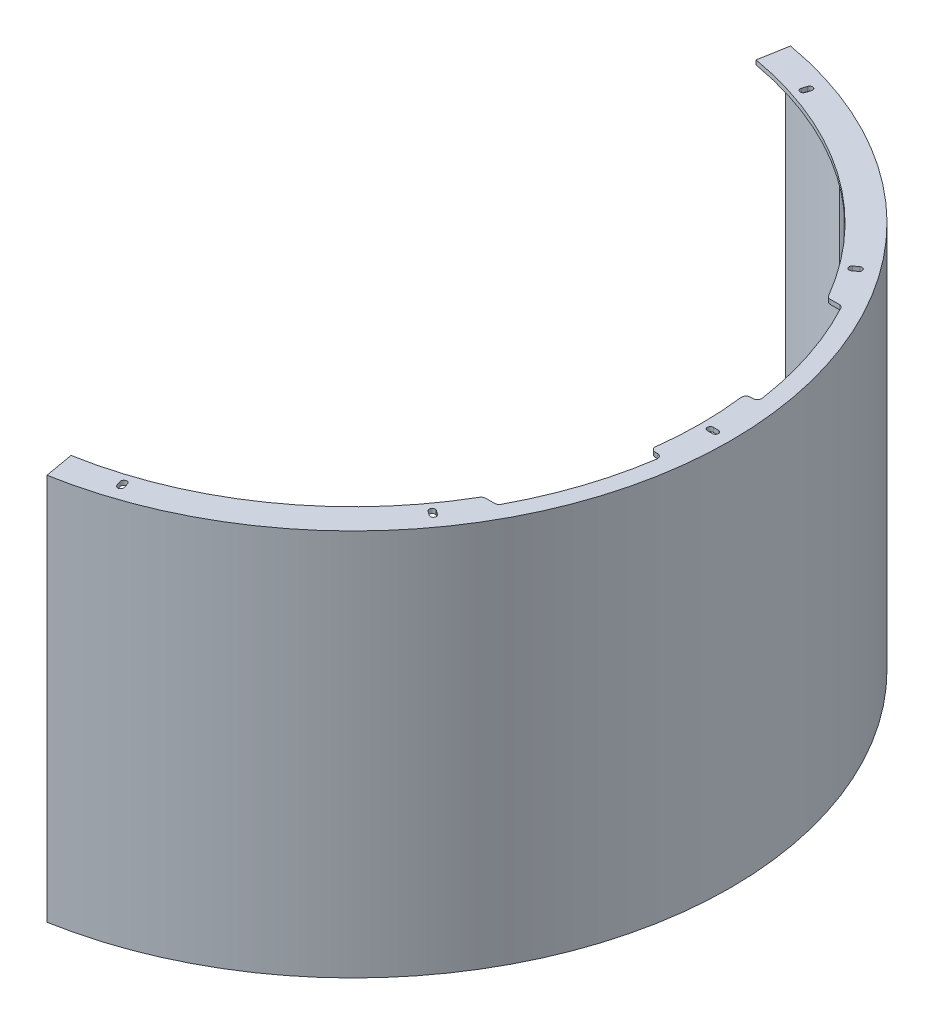
from build123d import *

# Parameters (mm, degrees)
BOSS_EXTRUDE1_DEPTH   = 255
BOSS_EXTRUDE2_DEPTH   = 255
BOSS_EXTRUDE2_2_DEPTH = 255
BOSS_EXTRUDE2_3_DEPTH = 255
BOSS_EXTRUDE2_4_DEPTH = 255
BOSS_EXTRUDE2_5_DEPTH = 255
BOSS_EXTRUDE2_6_DEPTH = 255
BOSS_EXTRUDE2_7_DEPTH = 255
BOSS_EXTRUDE2_8_DEPTH = 255
BOSS_EXTRUDE3_DEPTH   = 3
CUT_EXTRUDE3_DEPTH    = 5
LPATTERN1_COUNT       = 2
LPATTERN1_PITCH       = 258
LPATTERN2_COUNT       = 2
LPATTERN2_PITCH       = 258
CUT_EXTRUDE7_DEPTH    = 324
CUT_EXTRUDE10_DEPTH   = 5
FILLET2_R             = 3


with BuildPart() as part:
    # Sketch3 → Boss-Extrude1 (new body)
    with BuildSketch(Plane(origin=(0, 0, 0), x_dir=(1, 0, 0), z_dir=(0, 1, 0))):
        with BuildLine():
            ThreePointArc((0, -254.5), (-22.181136529, -253.531550664), (-44.193461216, -250.633573142))
            Line((-44.193461216, -250.633573142), (-43.672516683, -247.679149883))
            ThreePointArc((-43.672516683, -247.679149883), (-21.919669301, -250.54296657), (0, -251.5))
            ThreePointArc((0, -251.5), (251.5, 0), (0, 251.5))
            ThreePointArc((0, 251.5), (-21.919669301, 250.54296657), (-43.672516683, 247.679149883))
            Line((-43.672516683, 247.679149883), (-44.193461216, 250.633573142))
            ThreePointArc((-44.193461216, 250.633573142), (-22.181136529, 253.531550664), (0, 254.5))
            ThreePointArc((0, 254.5), (254.5, 0), (0, -254.5))
        make_face()
    extrude(amount=BOSS_EXTRUDE1_DEPTH)


with BuildPart() as body_2:
    # Sketch6 → Boss-Extrude2 (new body)
    with BuildSketch(Plane(origin=(0, 255, 0), x_dir=(1, 0, 0), z_dir=(0, 1, 0))):
        with BuildLine():
            Line((-2, -253.081926056), (2, -253.081926056))
            Line((2, -253.081926056), (2, -247.081926056))
            ThreePointArc((2, -247.081926056), (1.707106781, -246.374819275), (1, -246.081926056))
            Line((1, -246.081926056), (-1, -246.081926056))
            ThreePointArc((-1, -246.081926056), (-1.707106781, -246.374819275), (-2, -247.081926056))
            Line((-2, -247.081926056), (-2, -253.081926056))
        make_face()
    extrude(amount=-BOSS_EXTRUDE2_DEPTH)


with BuildPart() as body_3:
    # Sketch6 → Boss-Extrude2 2 (new body)
    with BuildSketch(Plane(origin=(0, 255, 0), x_dir=(1, 0, 0), z_dir=(0, 1, 0))):
        with BuildLine():
            Line((-1, 246.081926056), (1, 246.081926056))
            ThreePointArc((1, 246.081926056), (1.707106781, 246.374819275), (2, 247.081926056))
            Line((2, 247.081926056), (2, 253.081926056))
            Line((2, 253.081926056), (-2, 253.081926056))
            Line((-2, 253.081926056), (-2, 247.081926056))
            ThreePointArc((-2, 247.081926056), (-1.707106781, 246.374819275), (-1, 246.081926056))
        make_face()
    extrude(amount=-BOSS_EXTRUDE2_2_DEPTH)


with BuildPart() as body_4:
    # Sketch6 → Boss-Extrude2 3 (new body)
    with BuildSketch(Plane(origin=(0, 255, 0), x_dir=(1, 0, 0), z_dir=(0, 1, 0))):
        with BuildLine():
            Line((111.610070116, 227.151168927), (108.006194645, 228.886703884))
            Line((108.006194645, 228.886703884), (105.40289221, 223.480890676))
            ThreePointArc((105.40289221, 223.480890676), (105.359977747, 222.716727875), (105.869977339, 222.146038069))
            Line((105.869977339, 222.146038069), (107.671915074, 221.278270591))
            ThreePointArc((107.671915074, 221.278270591), (108.436077876, 221.235356129), (109.006767681, 221.74535572))
            Line((109.006767681, 221.74535572), (111.610070116, 227.151168927))
        make_face()
    extrude(amount=-BOSS_EXTRUDE2_3_DEPTH)


with BuildPart() as body_5:
    # Sketch6 → Boss-Extrude2 4 (new body)
    with BuildSketch(Plane(origin=(0, 255, 0), x_dir=(1, 0, 0), z_dir=(0, 1, 0))):
        with BuildLine():
            Line((199.114397038, 156.230336966), (196.620437831, 159.357662896))
            Line((196.620437831, 159.357662896), (191.929448936, 155.616724085))
            ThreePointArc((191.929448936, 155.616724085), (191.559226528, 154.946857078), (191.771107255, 154.2114028))
            Line((191.771107255, 154.2114028), (193.018086859, 152.647739835))
            ThreePointArc((193.018086859, 152.647739835), (193.687953865, 152.277517427), (194.423408143, 152.489398155))
            Line((194.423408143, 152.489398155), (199.114397038, 156.230336966))
        make_face()
    extrude(amount=-BOSS_EXTRUDE2_4_DEPTH)


with BuildPart() as body_6:
    # Sketch6 → Boss-Extrude2 5 (new body)
    with BuildSketch(Plane(origin=(0, 255, 0), x_dir=(1, 0, 0), z_dir=(0, 1, 0))):
        with BuildLine():
            Line((247.181675649, 54.366170729), (246.291591913, 58.265882378))
            Line((246.291591913, 58.265882378), (240.44202444, 56.930756774))
            ThreePointArc((240.44202444, 56.930756774), (239.817821175, 56.487860938), (239.689617462, 55.733307928))
            Line((239.689617462, 55.733307928), (240.13465933, 53.783452104))
            ThreePointArc((240.13465933, 53.783452104), (240.577555165, 53.159248838), (241.332108176, 53.031045125))
            Line((241.332108176, 53.031045125), (247.181675649, 54.366170729))
        make_face()
    extrude(amount=-BOSS_EXTRUDE2_5_DEPTH)


with BuildPart() as body_7:
    # Sketch6 → Boss-Extrude2 6 (new body)
    with BuildSketch(Plane(origin=(0, 255, 0), x_dir=(1, 0, 0), z_dir=(0, 1, 0))):
        with BuildLine():
            Line((246.291591913, -58.265882378), (247.181675649, -54.366170729))
            Line((247.181675649, -54.366170729), (241.332108176, -53.031045125))
            ThreePointArc((241.332108176, -53.031045125), (240.577555165, -53.159248838), (240.13465933, -53.783452104))
            Line((240.13465933, -53.783452104), (239.689617462, -55.733307928))
            ThreePointArc((239.689617462, -55.733307928), (239.817821175, -56.487860938), (240.44202444, -56.930756774))
            Line((240.44202444, -56.930756774), (246.291591913, -58.265882378))
        make_face()
    extrude(amount=-BOSS_EXTRUDE2_6_DEPTH)


with BuildPart() as body_8:
    # Sketch6 → Boss-Extrude2 7 (new body)
    with BuildSketch(Plane(origin=(0, 255, 0), x_dir=(1, 0, 0), z_dir=(0, 1, 0))):
        with BuildLine():
            Line((196.620437831, -159.357662896), (199.114397038, -156.230336966))
            Line((199.114397038, -156.230336966), (194.423408143, -152.489398155))
            ThreePointArc((194.423408143, -152.489398155), (193.687953865, -152.277517427), (193.018086859, -152.647739835))
            Line((193.018086859, -152.647739835), (191.771107255, -154.2114028))
            ThreePointArc((191.771107255, -154.2114028), (191.559226528, -154.946857078), (191.929448936, -155.616724085))
            Line((191.929448936, -155.616724085), (196.620437831, -159.357662896))
        make_face()
    extrude(amount=-BOSS_EXTRUDE2_7_DEPTH)


with BuildPart() as body_9:
    # Sketch6 → Boss-Extrude2 8 (new body)
    with BuildSketch(Plane(origin=(0, 255, 0), x_dir=(1, 0, 0), z_dir=(0, 1, 0))):
        with BuildLine():
            Line((108.006194645, -228.886703884), (111.610070116, -227.151168927))
            Line((111.610070116, -227.151168927), (109.006767681, -221.74535572))
            ThreePointArc((109.006767681, -221.74535572), (108.436077876, -221.235356129), (107.671915074, -221.278270591))
            Line((107.671915074, -221.278270591), (105.869977339, -222.146038069))
            ThreePointArc((105.869977339, -222.146038069), (105.359977747, -222.716727875), (105.40289221, -223.480890676))
            Line((105.40289221, -223.480890676), (108.006194645, -228.886703884))
        make_face()
    extrude(amount=-BOSS_EXTRUDE2_8_DEPTH)


with BuildPart() as body_3_1:
    add(body_3.part)

    # Combine2: union part, body 4, body 5, body 6, body 7, body 8, body 9, body 2
    add(part.part)
    add(body_4.part)
    add(body_5.part)
    add(body_6.part)
    add(body_7.part)
    add(body_8.part)
    add(body_9.part)
    add(body_2.part)

    # Sketch7 → Boss-Extrude3 (add)
    with BuildSketch(Plane(origin=(0, 255, 0), x_dir=(1, 0, 0), z_dir=(0, 1, 0))):
        with BuildLine():
            ThreePointArc((-44.193461216, 250.633573142), (254.5, 0), (-44.193461216, -250.633573142))
            Line((-44.193461216, -250.633573142), (-40.720497663, -230.937418081))
            ThreePointArc((-40.720497663, -230.937418081), (234.5, 0), (-40.720497663, 230.937418081))
            Line((-40.720497663, 230.937418081), (-44.193461216, 250.633573142))
        make_face()
    boss_extrude3 = extrude(amount=BOSS_EXTRUDE3_DEPTH)

    # Sketch8 → Cut-Extrude3 (cut)
    with BuildSketch(Plane.XZ.offset(-255)):
        with BuildLine():
            Line((240.8, 2), (244.2, 2))
            ThreePointArc((244.2, 2), (246.2, 0), (244.2, -2))
            Line((244.2, -2), (240.8, -2))
            ThreePointArc((240.8, -2), (238.8, 0), (240.8, 2))
        make_face()
        with BuildLine():
            Line((195.98686275, -139.920654763), (198.737520531, -141.919124621))
            ThreePointArc((198.737520531, -141.919124621), (199.179984015, -144.712729114), (196.386379522, -145.155192599))
            Line((196.386379522, -145.155192599), (193.635721741, -143.156722741))
            ThreePointArc((193.635721741, -143.156722741), (193.193258257, -140.363118247), (195.98686275, -139.920654763))
        make_face()
        with BuildLine():
            Line((76.313405278, -228.396375135), (77.364063059, -231.629967291))
            ThreePointArc((77.364063059, -231.629967291), (76.079984015, -234.150114312), (73.559836994, -232.866035268))
            Line((73.559836994, -232.866035268), (72.509179213, -229.632443113))
            ThreePointArc((72.509179213, -229.632443113), (73.793258257, -227.112296091), (76.313405278, -228.396375135))
        make_face()
        with BuildLine():
            Line((-72.509179213, -229.632443113), (-73.559836994, -232.866035268))
            ThreePointArc((-73.559836994, -232.866035268), (-76.079984015, -234.150114312), (-77.364063059, -231.629967291))
            Line((-77.364063059, -231.629967291), (-76.313405278, -228.396375135))
            ThreePointArc((-76.313405278, -228.396375135), (-73.793258257, -227.112296091), (-72.509179213, -229.632443113))
        make_face()
        with BuildLine():
            Line((-193.635721741, -143.156722741), (-196.386379522, -145.155192599))
            ThreePointArc((-196.386379522, -145.155192599), (-199.179984015, -144.712729114), (-198.737520531, -141.919124621))
            Line((-198.737520531, -141.919124621), (-195.98686275, -139.920654763))
            ThreePointArc((-195.98686275, -139.920654763), (-193.193258257, -140.363118247), (-193.635721741, -143.156722741))
        make_face()
        with BuildLine():
            Line((-240.8, -2), (-244.2, -2))
            ThreePointArc((-244.2, -2), (-246.2, 0), (-244.2, 2))
            Line((-244.2, 2), (-240.8, 2))
            ThreePointArc((-240.8, 2), (-238.8, 0), (-240.8, -2))
        make_face()
        with BuildLine():
            Line((-195.98686275, 139.920654763), (-198.737520531, 141.919124621))
            ThreePointArc((-198.737520531, 141.919124621), (-199.179984015, 144.712729114), (-196.386379522, 145.155192599))
            Line((-196.386379522, 145.155192599), (-193.635721741, 143.156722741))
            ThreePointArc((-193.635721741, 143.156722741), (-193.193258257, 140.363118247), (-195.98686275, 139.920654763))
        make_face()
        with BuildLine():
            Line((-76.313405278, 228.396375135), (-77.364063059, 231.629967291))
            ThreePointArc((-77.364063059, 231.629967291), (-76.079984015, 234.150114312), (-73.559836994, 232.866035268))
            Line((-73.559836994, 232.866035268), (-72.509179213, 229.632443113))
            ThreePointArc((-72.509179213, 229.632443113), (-73.793258257, 227.112296091), (-76.313405278, 228.396375135))
        make_face()
        with BuildLine():
            Line((72.509179213, 229.632443113), (73.559836994, 232.866035268))
            ThreePointArc((73.559836994, 232.866035268), (76.079984015, 234.150114312), (77.364063059, 231.629967291))
            Line((77.364063059, 231.629967291), (76.313405278, 228.396375135))
            ThreePointArc((76.313405278, 228.396375135), (73.793258257, 227.112296091), (72.509179213, 229.632443113))
        make_face()
        with BuildLine():
            Line((193.635721741, 143.156722741), (196.386379522, 145.155192599))
            ThreePointArc((196.386379522, 145.155192599), (199.179984015, 144.712729114), (198.737520531, 141.919124621))
            Line((198.737520531, 141.919124621), (195.98686275, 139.920654763))
            ThreePointArc((195.98686275, 139.920654763), (193.193258257, 140.363118247), (193.635721741, 143.156722741))
        make_face()
    cut_extrude3 = extrude(amount=-CUT_EXTRUDE3_DEPTH, mode=Mode.SUBTRACT)

    # LPattern1: Boss-Extrude3 ×2
    with Locations(*[(0, -i * LPATTERN1_PITCH, 0) for i in range(1, LPATTERN1_COUNT)]):
        add(boss_extrude3)

    # LPattern2: Cut-Extrude3 ×2
    with Locations(*[(0, -i * LPATTERN2_PITCH, 0) for i in range(1, LPATTERN2_COUNT)]):
        add(cut_extrude3, mode=Mode.SUBTRACT)

    # Sketch11 → Cut-Extrude7 (cut)
    with BuildSketch(Plane(origin=(0, 258, 0), x_dir=(1, 0, 0), z_dir=(0, 1, 0))):
        with BuildLine():
            Line((-44.193461216, 250.633573142), (0, 0))
            Line((0, 0), (44.193461216, 250.633573142))
            ThreePointArc((44.193461216, 250.633573142), (0, 254.5), (-44.193461216, 250.633573142))
        make_face()
    cut_extrude7 = extrude(amount=-CUT_EXTRUDE7_DEPTH, mode=Mode.SUBTRACT)

    # Mirror1: Cut-Extrude7 across plane
    add(cut_extrude7.mirror(Plane.XY), mode=Mode.SUBTRACT)

    # Sketch13 → Cut-Extrude10 (cut)
    with BuildSketch(Plane(origin=(0, 258, 0), x_dir=(1, 0, 0), z_dir=(0, 1, 0))):
        with BuildLine():
            Line((240.8, 32.135476301), (189.842924972, 32.135476301))
            Line((189.842924972, 32.135476301), (189.842924972, 116.171040312))
            Line((189.842924972, 116.171040312), (213.357957972, 116.171040312))
            ThreePointArc((213.357957972, 116.171040312), (230.93366299, 75.412015854), (240.8, 32.135476301))
        make_face()
        with BuildLine():
            Line((189.842924972, -116.171040312), (213.357957972, -116.171040312))
            ThreePointArc((213.357957972, -116.171040312), (230.93366299, -75.412015854), (240.8, -32.135476301))
            Line((240.8, -32.135476301), (189.842924972, -32.135476301))
            Line((189.842924972, -32.135476301), (189.842924972, -116.171040312))
        make_face()
    extrude(amount=-CUT_EXTRUDE10_DEPTH, mode=Mode.SUBTRACT)

    # Fillet2
    fillet2_edges = [body_3_1.edges().sort_by_distance(p)[0] for p in [
        (213.357957972, 256.5, -116.171040312),
        (232.287668986, 256.5, -32.135476301),
        (240.8, 256.5, -32.135476301),
        (203.702084901, 256.5, -116.171040312),
        (240.8, 256.5, 32.135476301),
        (203.702084901, 256.5, 116.171040312),
        (213.357957972, 256.5, 116.171040312),
        (232.287668986, 256.5, 32.135476301),
    ]]
    fillet(fillet2_edges, radius=FILLET2_R)


solid = body_3_1.part
